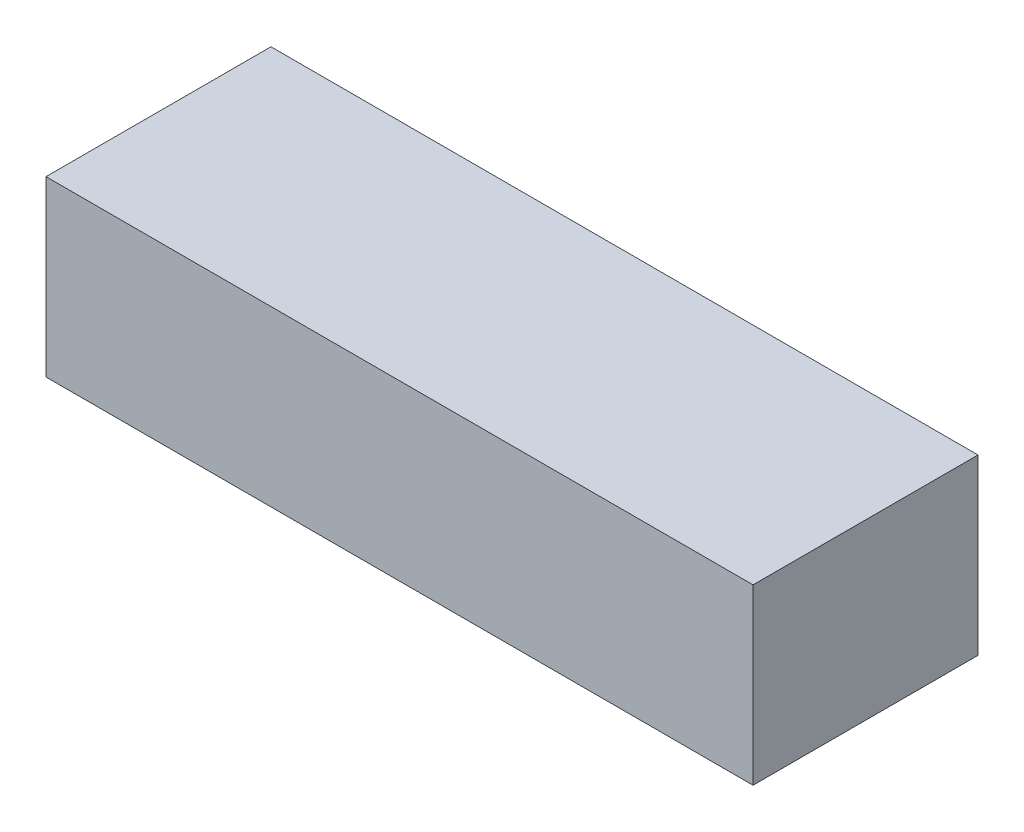
from build123d import *

# Parameters (mm, degrees)
SKETCH_1_W      = 110
SKETCH_1_H      = 35
EXTRUDE_1_DEPTH = 27


with BuildPart() as part:
    # 草图1 → 凸台-拉伸1 (new body)
    with BuildSketch(Plane(origin=(0, 0, 0), x_dir=(1, 0, 0), z_dir=(0, 1, 0))):
        Rectangle(SKETCH_1_W, SKETCH_1_H)
    extrude(amount=EXTRUDE_1_DEPTH)


solid = part.part
